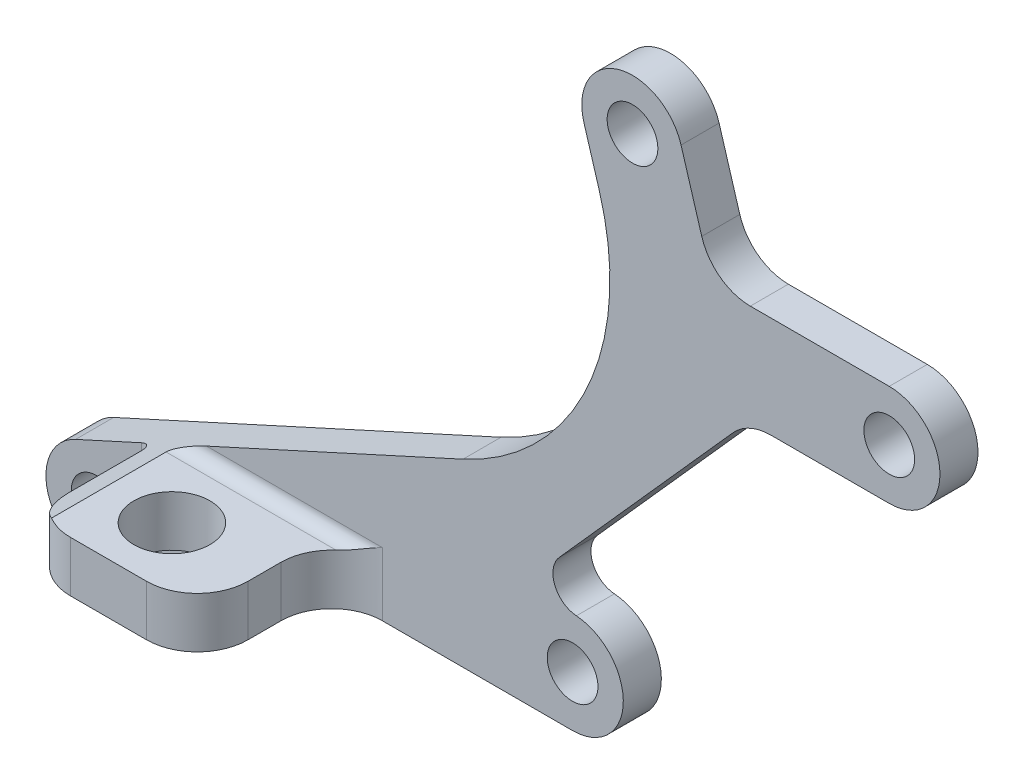
from build123d import *

# Parameters (mm, degrees)
ESQUISSE1_R             = 1
BOSS_EXTRU_1_DEPTH      = 1.5
CONG_1_R                = 2
CONG_2_R                = 1
ESQUISSE2_W             = 7
ESQUISSE2_H             = 2
BOSS_EXTRU_2_DEPTH      = 6.8
CONG_3_R                = 0.5
CONG_4_R                = 0.5
CONG_5_R                = 2
CONG_6_R                = 2
ESQUISSE3_R             = 1.5
ENL_V_MAT_EXTRU_1_DEPTH = 5
CONG_7_R                = 5
ENL_V_MAT_EXTRU_2_DEPTH = 7


with BuildPart() as part:
    # Esquisse1 → Boss.-Extru.1 (new body)
    with BuildSketch(Plane.XY):
        with BuildLine():
            Line((5.725874922, 0), (15.999999988, 0))
            ThreePointArc((15.999999988, 0), (18.000588979, 2.000588991), (15.999999988, 4.001177983))
            Line((15.999999988, 4.001177983), (13.999999884, 4.001177983))
            Line((13.999999884, 4.001177983), (22.919071704, 14.001177983))
            Line((22.919071704, 14.001177983), (28.487225861, 14.001177983))
            ThreePointArc((28.487225861, 14.001177983), (30.487225861, 16.001177983), (28.487225861, 18.001177983))
            Line((28.487225861, 18.001177983), (21.522063421, 18.001177983))
            Line((21.522063421, 18.001177983), (20.277949706, 22.137339224))
            ThreePointArc((20.277949706, 22.137339224), (17.786631004, 23.476492361), (16.447477867, 20.98517366))
            Line((16.447477867, 20.98517366), (17.053942849, 18.968929547))
            ThreePointArc((17.053942849, 18.968929547), (16.590729073, 12.03075257), (11.678911432, 7.108668233))
            Line((11.678911432, 7.108668233), (-3.597341835, 0.147035641))
            ThreePointArc((-3.597341835, 0.147035641), (-4.587900453, -2.502264951), (-1.938599861, -3.492823569))
            Line((-1.938599861, -3.492823569), (5.725874922, 0))
        make_face()
        with Locations((28.487225861, 16.001177983)):
            Circle(ESQUISSE1_R, mode=Mode.SUBTRACT)
        with Locations((15.999999988, 2.000588991)):
            Circle(ESQUISSE1_R, mode=Mode.SUBTRACT)
        with Locations((18.362713786, 21.561256442)):
            Circle(ESQUISSE1_R, mode=Mode.SUBTRACT)
        with Locations((-2.767970848, -1.672893964)):
            Circle(ESQUISSE1_R, mode=Mode.SUBTRACT)
    extrude(amount=BOSS_EXTRU_1_DEPTH)

    # Congé1
    cong_1_edges = [part.edges().sort_by_distance(p)[0] for p in [
        (21.522063421, 18.001177983, 0.75),
        (22.919071704, 14.001177983, 0.75),
    ]]
    fillet(cong_1_edges, radius=CONG_1_R)

    # Congé2
    cong_2_edges = [part.edges().sort_by_distance(p)[0] for p in [
        (13.999999884, 4.001177983, 0.75),
    ]]
    fillet(cong_2_edges, radius=CONG_2_R)

    # Esquisse2 → Boss.-Extru.2 (add)
    with BuildSketch(Plane(origin=(0, 0, 0), x_dir=(-1, 0, 0), z_dir=(0, 0, -1))):
        with Locations((-2.999999988, 1)):
            Rectangle(ESQUISSE2_W, ESQUISSE2_H)
    extrude(amount=-BOSS_EXTRU_2_DEPTH)

    # Congé3
    cong_3_edges = [part.edges().sort_by_distance(p)[0] for p in [
        (3.484354553, 2, 1.5),
    ]]
    fillet(cong_3_edges, radius=CONG_3_R)

    # Congé4
    cong_4_edges = [part.edges().sort_by_distance(p)[0] for p in [
        (-0.500000012, 0.779271889, 1.5),
    ]]
    fillet(cong_4_edges, radius=CONG_4_R)

    # Congé5
    cong_5_edges = [part.edges().sort_by_distance(p)[0] for p in [
        (6.499999988, 1.25, 1.5),
    ]]
    fillet(cong_5_edges, radius=CONG_5_R)

    # Congé6
    cong_6_edges = [part.edges().sort_by_distance(p)[0] for p in [
        (6.499999988, 1, 6.8),
        (-0.500000012, 1, 6.8),
    ]]
    fillet(cong_6_edges, radius=CONG_6_R)

    # Esquisse3 → Enlèv. mat.-Extru.1 (cut)
    with BuildSketch(Plane(origin=(0, 2, 0), x_dir=(1, 0, 0), z_dir=(0, 1, 0))):
        with Locations(Location((2.999999988, -4.3, 0), (0, 0, 270))):
            Circle(ESQUISSE3_R)
    extrude(amount=-ENL_V_MAT_EXTRU_1_DEPTH, mode=Mode.SUBTRACT)

    # Congé7
    cong_7_edges = [part.edges().sort_by_distance(p)[0] for p in [
        (5.725874922, 0, 0.75),
    ]]
    fillet(cong_7_edges, radius=CONG_7_R)

    # Esquisse4 → Enlèv. mat.-Extru.2 (cut)
    with BuildSketch(Plane(origin=(0, 0, 0), x_dir=(-1, 0, 0), z_dir=(0, 0, -1))):
        Polygon((0.500000012, 2), (-0.468709119, 2), (0.500000012, 1.558543777), align=None)
    extrude(amount=-ENL_V_MAT_EXTRU_2_DEPTH, mode=Mode.SUBTRACT)


solid = part.part
